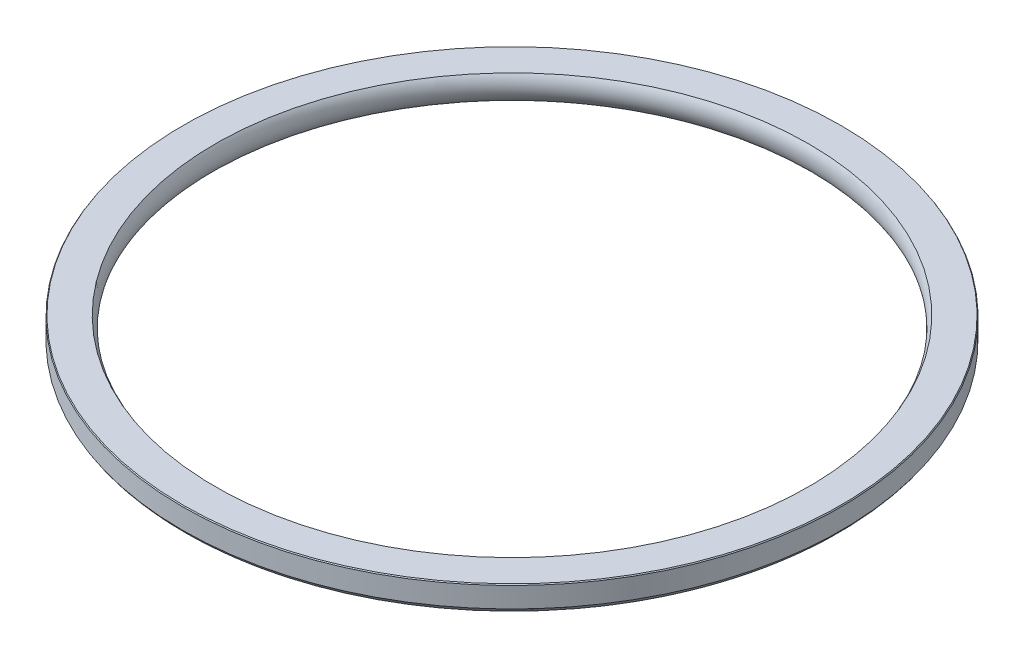
from build123d import *


with BuildPart() as part:
    # Schizzo1 → Rivoluzione1 (revolve)
    with BuildSketch(Plane.XY, mode=Mode.PRIVATE) as rivoluzione1_sk:
        with BuildLine():
            Line((-13.510616699, 0.51), (-14.969383301, 0.51))
            ThreePointArc((-14.969383301, 0.51), (-14.985060122, 0.486811477), (-15, 0.463141447))
            Line((-15, 0.463141447), (-15, -0.463141447))
            ThreePointArc((-15, -0.463141447), (-13.999479731, -0.856883889), (-13.35, 0))
            ThreePointArc((-13.35, 0), (-13.391103323, 0.267347024), (-13.510616699, 0.51))
        make_face()
    revolve(rivoluzione1_sk.sketch.rotate(Axis((0, 0, 0), (0, 1, 0)), 270), axis=Axis((0, 0, 0), (0, 1, 0)))


solid = part.part
